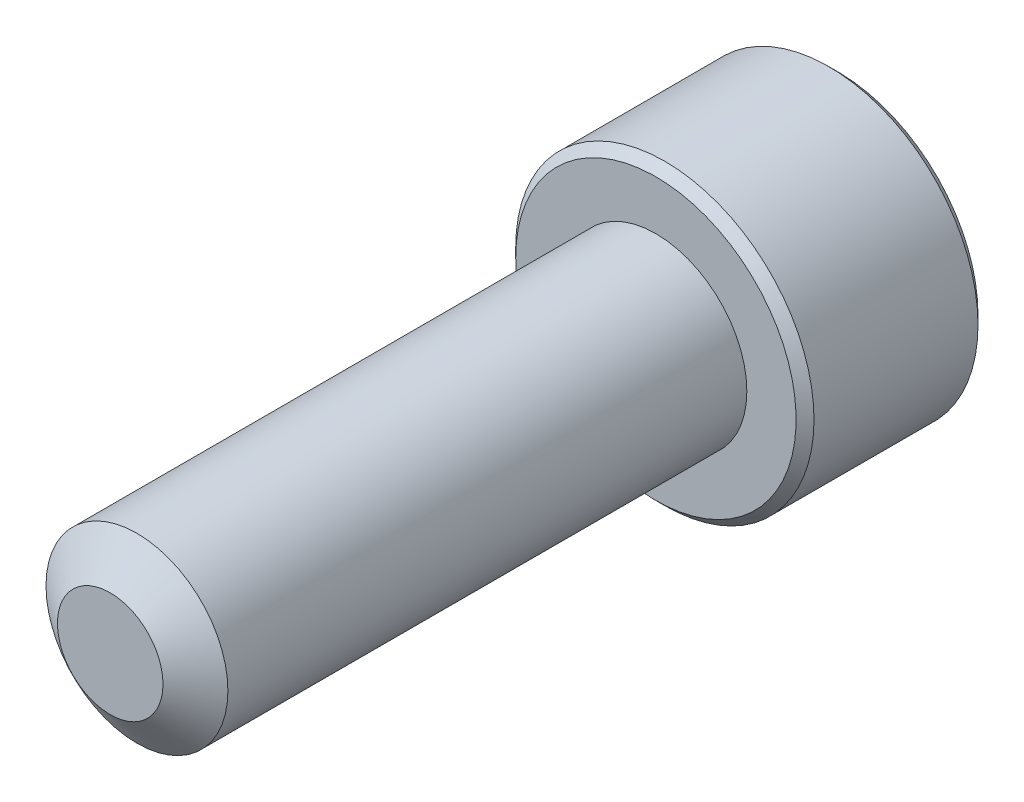
from build123d import *

# Parameters (mm, degrees)
SKETCH1_R          = 1.5875
EXTRUDE1_DEPTH     = 9.525
SKETCH6_R          = 2.6035
EXTRUDE2_DEPTH     = 3.175
CUT_EXTRUDE1_DEPTH = 1.7859375
CHAMFER1_SIZE      = 0.15621


with BuildPart() as part:
    # Sketch1 → Extrude1 (new body)
    with BuildSketch(Plane.XY):
        Circle(SKETCH1_R)
    extrude(amount=-EXTRUDE1_DEPTH)

    # Sketch4 → Cut-Revolve1 (revolve, cut)
    with BuildSketch(Plane(origin=(0, 0, 0), x_dir=(0, 0, -1), z_dir=(1, 0, 0))):
        Polygon((0.466649532, 1.5875), (0, 0.921055401), (0, 1.5875), align=None)
    revolve(axis=Axis((0, 0, 0), (0, 0, -1)), mode=Mode.SUBTRACT)

    # Sketch6 → Extrude2 (add)
    with BuildSketch(Plane(origin=(0, 0, -9.525), x_dir=(-1, 0, 0), z_dir=(0, 0, -1))):
        Circle(SKETCH6_R)
    extrude(amount=EXTRUDE2_DEPTH)

    # Sketch7 → Cut-Extrude1 (cut)
    with BuildSketch(Plane(origin=(0, 0, -12.7), x_dir=(-1, 0, 0), z_dir=(0, 0, -1))):
        Polygon((0, 1.374815329), (-1.190625, 0.687407664), (-1.190625, -0.687407664), (0, -1.374815329), (1.190625, -0.687407664), (1.190625, 0.687407664), align=None)
    extrude(amount=-CUT_EXTRUDE1_DEPTH, mode=Mode.SUBTRACT)

    # Cut-Extrude2 cone 1 section (through the dimple's axis) → Cut-Extrude2 (revolve, cut)
    with BuildSketch(Plane(origin=(0, 0, -12.7), x_dir=(0, 1, 0), z_dir=(1, 0, 0))):
        Polygon((0, 0), (1.374815329, 0), (0, 1.374815329), align=None)
    revolve(axis=Axis((0, 0, -12.7), (0, 0, 1)), mode=Mode.SUBTRACT)

    # Chamfer1
    chamfer1_edges = [part.edges().sort_by_distance(p)[0] for p in [
        (2.6035, 0, -12.7),
        (2.6035, 0, -9.525),
    ]]
    chamfer(chamfer1_edges, length=CHAMFER1_SIZE)


solid = part.part
